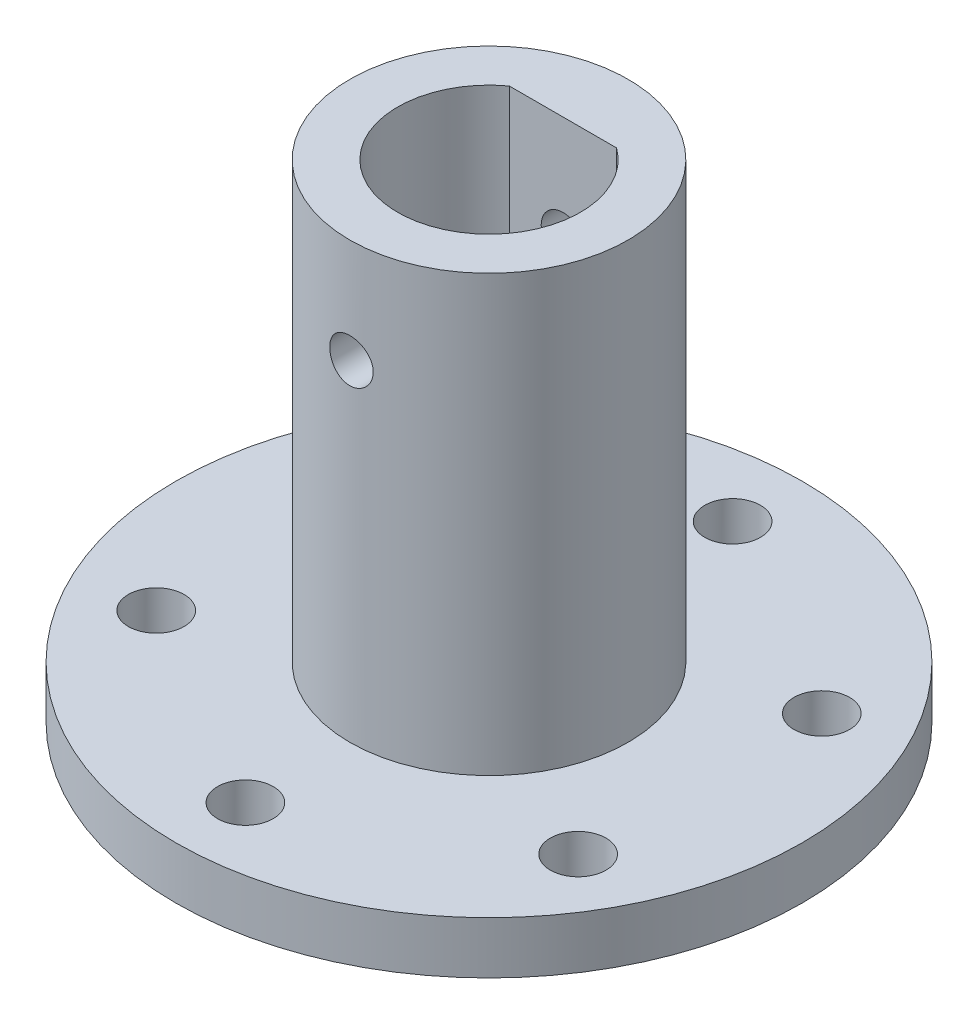
from build123d import *

# Parameters (mm, degrees)
SKETCH_2_R          = 1.6
CUT_EXTRUDE_1_DEPTH = 10
EXTRUDE_START       = -28
EXTRUDE_1_DEPTH     = 28
HOLE_WIZARD_M3_2_D  = 2.5


with BuildPart() as part:
    # 草图1 → 旋转1 (revolve)
    with BuildSketch(Plane.XY, mode=Mode.PRIVATE) as revolve_1_sk:
        Polygon((-5.25, 0), (-18, 0), (-18, 3), (-8, 3), (-8, 28), (-5.25, 28), align=None)
    revolve(revolve_1_sk.sketch.rotate(Axis((0, 12.843932511, 0), (0, -1, 0)), 270), axis=Axis((0, 12.843932511, 0), (0, -1, 0)))

    # 草图2 → 切除-拉伸1 (cut)
    with BuildSketch(Plane(origin=(0, 3, 0), x_dir=(1, 0, 0), z_dir=(0, 1, 0))):
        with Locations(Location((0, 14, 0), (0, 0, 270))):
            Circle(SKETCH_2_R)
        with Locations(Location((12.124355653, 7, 0), (0, 0, 270))):
            Circle(SKETCH_2_R)
        with Locations(Location((12.124355653, -7, 0), (0, 0, 270))):
            Circle(SKETCH_2_R)
        with Locations(Location((0, -14, 0), (0, 0, 270))):
            Circle(SKETCH_2_R)
        with Locations(Location((-12.124355653, -7, 0), (0, 0, 270))):
            Circle(SKETCH_2_R)
        with Locations(Location((-12.124355653, 7, 0), (0, 0, 270))):
            Circle(SKETCH_2_R)
    extrude(amount=-CUT_EXTRUDE_1_DEPTH, mode=Mode.SUBTRACT)

    # 草图3 → 凸台-拉伸1 (add)
    with BuildSketch(Plane(origin=(0, 28, 0), x_dir=(1, 0, 0), z_dir=(0, 1, 0)).offset(EXTRUDE_START)):
        with BuildLine():
            Line((-3.082207001, 4.25), (3.082207001, 4.25))
            ThreePointArc((3.082207001, 4.25), (0, 5.25), (-3.082207001, 4.25))
        make_face()
    extrude(amount=EXTRUDE_1_DEPTH)

    # M3 螺纹孔2 (through all)
    with Locations(Plane(origin=(0, 0, -10), x_dir=(1, 0, 0), z_dir=(0, 0, -1))):
        with Locations((0, -22)):
            Hole(HOLE_WIZARD_M3_2_D / 2)


solid = part.part
